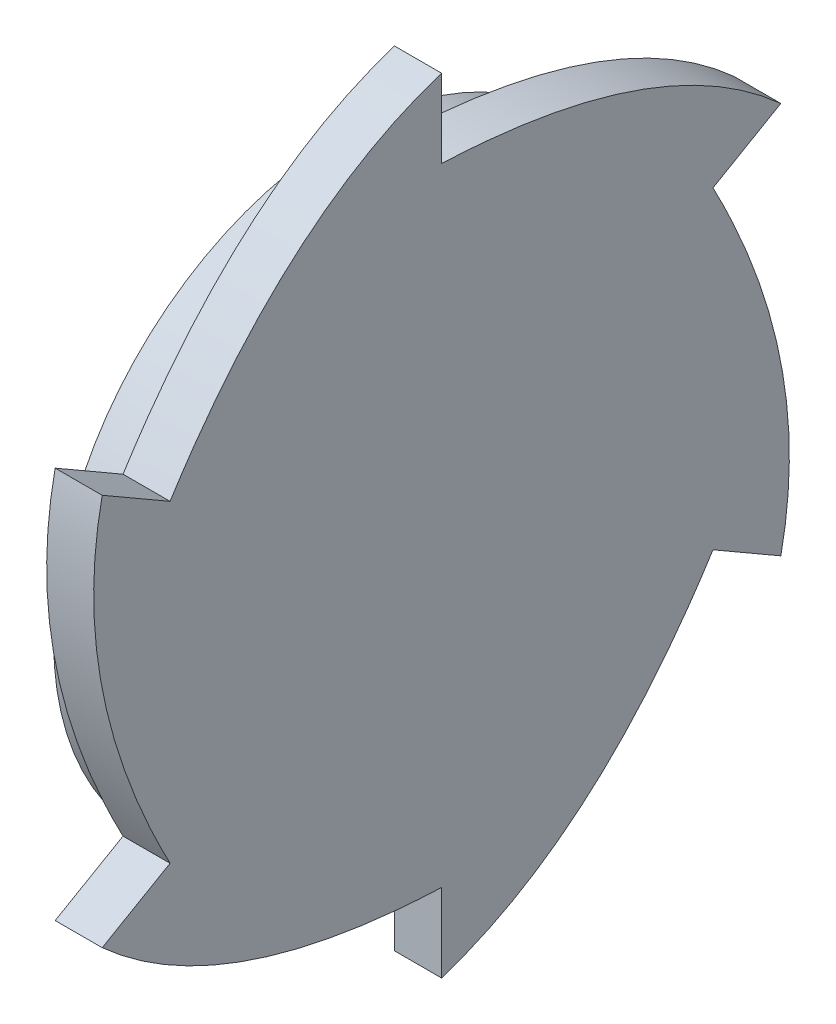
from build123d import *

# Parameters (mm, degrees)
BOSS_EXTRUDE1_DEPTH = 30
SKETCH2_R           = 150
BOSS_EXTRUDE2_DEPTH = 30
SCALE1_SCALE_X      = 1
SCALE1_SCALE_Y      = 1.25
SCALE1_SCALE_Z      = 1.25


with BuildPart() as part:
    # Sketch1 → Boss-Extrude1 (new body)
    with BuildSketch(Plane(origin=(0, 0, 0), x_dir=(0, 0, -1), z_dir=(1, 0, 0))):
        with BuildLine():
            Line((0, 160), (0, 200))
            add(Edge.make_bspline(
                [(-138.564064606, 80), (-78.974925655, 174.42159167), (0, 200)],
                knots=[0, 0, 0, 0.458760962, 0.458760962, 0.458760962], degree=2))
            Line((-138.564064606, 80), (-173.205080757, 100))
            add(Edge.make_bspline(
                [(-138.564064606, -80), (-190.540992182, 18.816503955), (-173.205080757, 100)],
                knots=[0, 0, 0, 0.458760962, 0.458760962, 0.458760962], degree=2))
            Line((-138.564064606, -80), (-173.205080757, -100))
            add(Edge.make_bspline(
                [(0, -160), (-111.566066527, -155.605087714), (-173.205080757, -100)],
                knots=[0, 0, 0, 0.458760962, 0.458760962, 0.458760962], degree=2))
            Line((0, -160), (0, -200))
            add(Edge.make_bspline(
                [(138.564064606, -80), (78.974925655, -174.42159167), (0, -200)],
                knots=[0, 0, 0, 0.458760962, 0.458760962, 0.458760962], degree=2))
            Line((138.564064606, -80), (173.205080757, -100))
            add(Edge.make_bspline(
                [(138.564064606, 80), (190.540992182, -18.816503955), (173.205080757, -100)],
                knots=[0, 0, 0, 0.458760962, 0.458760962, 0.458760962], degree=2))
            Line((138.564064606, 80), (173.205080757, 100))
            add(Edge.make_bspline(
                [(0, 160), (111.566066527, 155.605087714), (173.205080757, 100)],
                knots=[0, 0, 0, 0.458760962, 0.458760962, 0.458760962], degree=2))
        make_face()
    extrude(amount=BOSS_EXTRUDE1_DEPTH)

    # Sketch2 → Boss-Extrude2 (add)
    with BuildSketch(Plane.ZY):
        with Locations(Location((0, 0, 0), (0, 0, 180))):
            Circle(SKETCH2_R)
    extrude(amount=BOSS_EXTRUDE2_DEPTH)


with BuildPart() as part_1:
    # Scale1: scaled about (2.201532239, 0, 0)
    add(part.part.scale((SCALE1_SCALE_X, SCALE1_SCALE_Y, SCALE1_SCALE_Z), about=(2.201532239, 0, 0)))


solid = part_1.part
